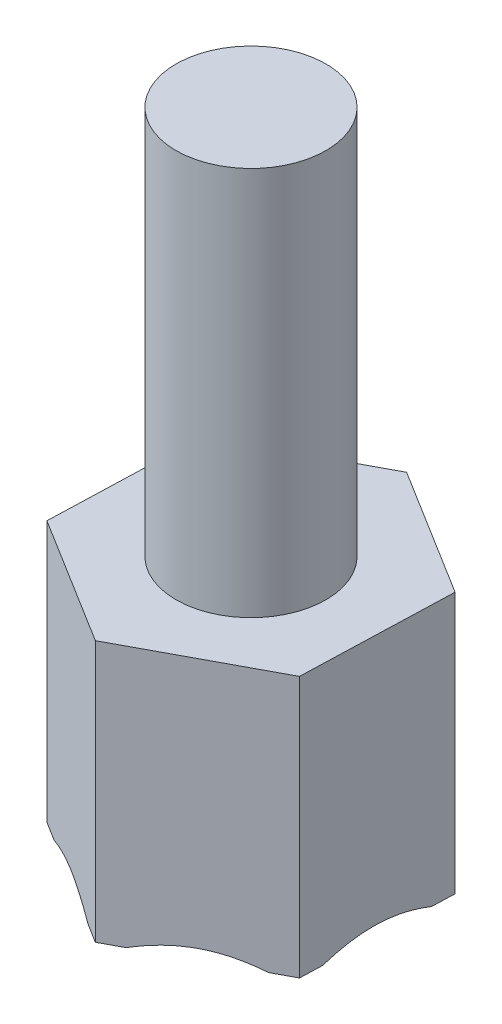
from build123d import *

# Parameters (mm, degrees)
EXTRUDE_1_DEPTH                 = 4.7
HOLE_WIZARD_10_24_1_D           = 3.7973
HOLE_WIZARD_10_24_1_DEPTH       = 4
HOLE_WIZARD_10_24_1_CSINK_D     = 5.0673
HOLE_WIZARD_10_24_1_CSINK_ANGLE = 90
SKETCH_5_R                      = 1.35
EXTRUDE_2_DEPTH                 = 7


with BuildPart() as part:
    # 草图1 → 凸台-拉伸1 (new body)
    with BuildSketch(Plane(origin=(0, 0, 0), x_dir=(1, 0, 0), z_dir=(0, 1, 0))):
        Polygon((2.304627048, -1.432489966), (2.392886225, 1.279620587), (0.088259177, 2.712110553), (-2.304627048, 1.432489966), (-2.392886225, -1.279620587), (-0.088259177, -2.712110553), align=None)
    extrude(amount=EXTRUDE_1_DEPTH)

    # #10-24 螺纹孔1
    with Locations(Plane.XZ):
        with Locations((0, 0)):
            CounterSinkHole(HOLE_WIZARD_10_24_1_D / 2, HOLE_WIZARD_10_24_1_CSINK_D / 2, depth=HOLE_WIZARD_10_24_1_DEPTH, counter_sink_angle=HOLE_WIZARD_10_24_1_CSINK_ANGLE)

    # 草图5 → 凸台-拉伸2 (add)
    with BuildSketch(Plane(origin=(0, 4.7, 0), x_dir=(-1, 0, 0), z_dir=(0, 1, 0))):
        with Locations(Location((0, 0, 0), (0, 0, 90))):
            Circle(SKETCH_5_R)
    extrude(amount=EXTRUDE_2_DEPTH)


solid = part.part
